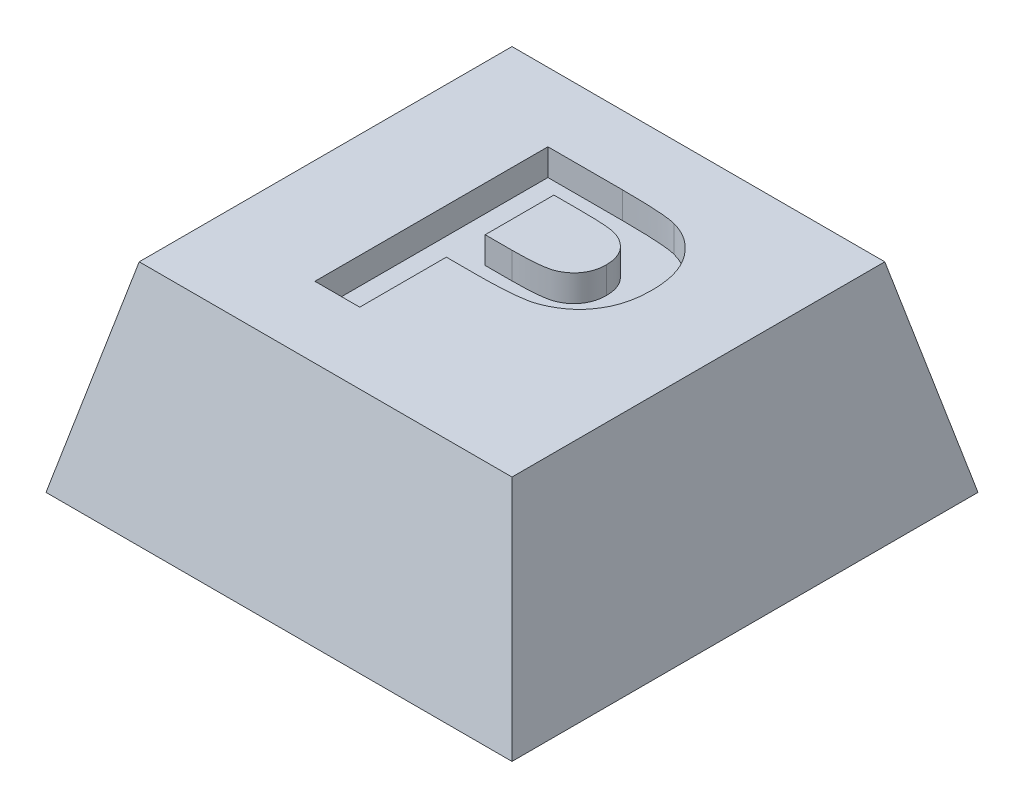
from build123d import *

# Parameters (mm, degrees)
SKETCH1_W           = 7
SKETCH1_H           = 7
BOSS_EXTRUDE1_DEPTH = 3
CUT_EXTRUDE1_DEPTH  = 7
CUT_EXTRUDE2_DEPTH  = 11
SKETCH4_R           = 1.8
CUT_EXTRUDE3_DEPTH  = 0.8
CUT_EXTRUDE4_DEPTH  = 0.4


with BuildPart() as part:
    # Sketch1 → Boss-Extrude1 (new body)
    with BuildSketch(Plane(origin=(0, 0, 0), x_dir=(1, 0, 0), z_dir=(0, 1, 0))):
        with Locations((3.5, 3.5)):
            Rectangle(SKETCH1_W, SKETCH1_H)
    extrude(amount=BOSS_EXTRUDE1_DEPTH)

    # Sketch2 → Cut-Extrude1 (cut)
    with BuildSketch(Plane.XY):
        Polygon((0, 0), (0.7, 3), (0, 3), align=None)
        Polygon((7, 0), (6.3, 3), (7, 3), align=None)
    extrude(amount=-CUT_EXTRUDE1_DEPTH, mode=Mode.SUBTRACT)

    # Sketch3 → Cut-Extrude2 (cut)
    with BuildSketch(Plane(origin=(0, 0, 0), x_dir=(0, 0, -1), z_dir=(1, 0, 0))):
        Polygon((0, 0), (0.7, 3), (0, 3), align=None)
        Polygon((7, 3), (6.3, 3), (7, 0), align=None)
    extrude(amount=CUT_EXTRUDE2_DEPTH, mode=Mode.SUBTRACT)

    # Sketch4 → Cut-Extrude3 (cut)
    with BuildSketch(Plane.XZ):
        with Locations(Location((3.5, -3.5, 0), (0, 0, 270))):
            Circle(SKETCH4_R)
    extrude(amount=-CUT_EXTRUDE3_DEPTH, mode=Mode.SUBTRACT)

    # Sketch5 → Cut-Extrude4 (cut)
    with BuildSketch(Plane(origin=(0, 3, 0), x_dir=(1, 0, 0), z_dir=(0, 1, 0))):
        with BuildLine():
            Line((2.273436966, 1.766029319), (2.273436966, 5.266029319))
            Line((2.273436966, 5.266029319), (3.393128472, 5.266029319))
            add(Edge.make_bspline(
                [(3.393128472, 5.266029319), (3.443844607, 5.265973935), (3.540845243, 5.265868005), (3.679210782, 5.262924846), (3.803788221, 5.25875848), (3.914392667, 5.253569447), (4.011413307, 5.245826414), (4.094414918, 5.236860098), (4.163920155, 5.227214721), (4.20484973, 5.217233046), (4.223256678, 5.212744063)],
                knots=[0, 0, 0, 0, 1.460485487, 2.793352117, 3.985295279, 5.050041172, 5.981765236, 6.787433016, 7.454681457, 8, 8, 8, 8], degree=3))
            add(Edge.make_bspline(
                [(4.223256678, 5.212744063), (4.247733441, 5.205764794), (4.296314082, 5.191912581), (4.365914991, 5.162381864), (4.432999247, 5.128157338), (4.496724006, 5.087367889), (4.55730589, 5.040737674), (4.614924976, 4.988646969), (4.669888538, 4.930860625), (4.721436225, 4.867492795), (4.768647843, 4.798863014), (4.809450543, 4.724869813), (4.843634674, 4.645834805), (4.872758986, 4.562351928), (4.894247042, 4.473526111), (4.909284774, 4.379974525), (4.919752913, 4.281656252), (4.920494089, 4.214375246), (4.920872863, 4.179991659)],
                knots=[0, 0, 0, 0, 0.907145743, 1.80047177, 2.69161667, 3.591261238, 4.495029544, 5.415863088, 6.359363025, 7.337192411, 8.326890979, 9.326929023, 10.346104993, 11.395420813, 12.477187422, 13.601053412, 14.774031606, 16, 16, 16, 16], degree=3))
            add(Edge.make_bspline(
                [(4.920872863, 4.179991659), (4.919792601, 4.127776273), (4.917713038, 4.027258789), (4.894446409, 3.883154793), (4.858959078, 3.751525082), (4.807091778, 3.633637523), (4.743854765, 3.529029507), (4.674197894, 3.434725874), (4.594659983, 3.353569033), (4.508726287, 3.284249259), (4.417910076, 3.227520832), (4.326929468, 3.179160654), (4.234556815, 3.141979803), (4.171577346, 3.125779808), (4.140524306, 3.11779214)],
                knots=[0, 0, 0, 0, 1.312386234, 2.526415563, 3.661883817, 4.733421185, 5.753802465, 6.732107337, 7.675884281, 8.604170108, 9.50284679, 10.365392406, 11.194030444, 12, 12, 12, 12], degree=3))
            add(Edge.make_bspline(
                [(4.140524306, 3.11779214), (4.118360169, 3.113576), (4.071640813, 3.10468888), (3.997546708, 3.09583004), (3.916557837, 3.086024269), (3.828341085, 3.079628394), (3.733003173, 3.073638926), (3.63058112, 3.0708111), (3.521221299, 3.067404144), (3.44594969, 3.067342926), (3.407150908, 3.06731137)],
                knots=[0, 0, 0, 0, 0.735353946, 1.55003838, 2.431865514, 3.394945452, 4.432993119, 5.54609699, 6.735134699, 8, 8, 8, 8], degree=3))
            Line((3.407150908, 3.06731137), (2.946513889, 3.06731137))
            Line((2.946513889, 3.06731137), (2.946513889, 1.766029319))
            Line((2.946513889, 1.766029319), (2.273436966, 1.766029319))
        make_face()
        with BuildLine():
            Line((2.946513889, 4.682695986), (2.946513889, 3.650644704))
            Line((2.946513889, 3.650644704), (3.350360043, 3.650644704))
            add(Edge.make_bspline(
                [(3.350360043, 3.650644704), (3.385185484, 3.6506898), (3.451810934, 3.650776074), (3.547403676, 3.653872817), (3.633934317, 3.657652965), (3.711583659, 3.663909885), (3.779882991, 3.672156355), (3.839289696, 3.682020172), (3.889873011, 3.692605078), (3.94457198, 3.710145964), (4.003056114, 3.738525517), (4.065510296, 3.779314064), (4.120376221, 3.828081582), (4.166031944, 3.885357343), (4.202500757, 3.948994033), (4.228612454, 4.01833948), (4.245472753, 4.092244389), (4.247012787, 4.143440235), (4.24779594, 4.169474832)],
                knots=[0, 0, 0, 0, 1.411705958, 2.700771114, 3.876961699, 4.922619712, 5.858038221, 6.66485904, 7.363650596, 7.950905807, 8.989198271, 9.987739806, 10.967313358, 11.951275539, 12.944273208, 13.927870418, 14.946261014, 16, 16, 16, 16], degree=3))
            add(Edge.make_bspline(
                [(4.24779594, 4.169474832), (4.246693738, 4.201184565), (4.244556714, 4.262665556), (4.220991303, 4.350224748), (4.184632567, 4.429685776), (4.132649896, 4.498576249), (4.069856053, 4.556507472), (3.999278394, 4.604708309), (3.919409702, 4.638439621), (3.862884076, 4.65150926), (3.834134081, 4.658156723)],
                knots=[0, 0, 0, 0, 1.085904563, 2.105425768, 3.088705091, 4.068969419, 5.045188284, 6.010769642, 6.988240112, 8, 8, 8, 8], degree=3))
            add(Edge.make_bspline(
                [(3.834134081, 4.658156723), (3.821762302, 4.660135488), (3.794300788, 4.664527734), (3.748654162, 4.669111588), (3.694654197, 4.673280599), (3.6322358, 4.676703481), (3.561646383, 4.679379383), (3.482653109, 4.681724132), (3.395464024, 4.681912502), (3.334467378, 4.682427589), (3.302683761, 4.682695986)],
                knots=[0, 0, 0, 0, 0.564603001, 1.253243608, 2.066786758, 3.005752288, 4.070476343, 5.250658742, 6.567396469, 8, 8, 8, 8], degree=3))
            Line((3.302683761, 4.682695986), (2.946513889, 4.682695986))
        make_face(mode=Mode.SUBTRACT)
    extrude(amount=-CUT_EXTRUDE4_DEPTH, mode=Mode.SUBTRACT)


solid = part.part
